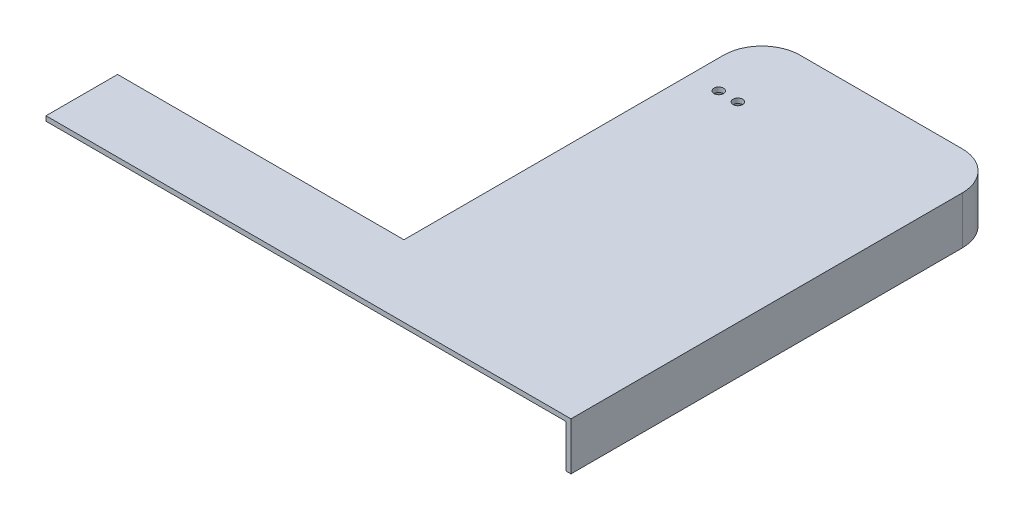
from build123d import *

# Parameters (mm, degrees)
BOSS_EXTRUDE1_DEPTH = 25.4
FILLET1_R           = 20.32
SHELL1_T            = -2.54
SKETCH2_R           = 2.54
CUT_EXTRUDE1_DEPTH  = 347.409815103
CUT_EXTRUDE2_DEPTH  = 347.409815103


with BuildPart() as part:
    # Sketch1 → Boss-Extrude1 (new body)
    with BuildSketch(Plane(origin=(0, 0, 0), x_dir=(1, 0, 0), z_dir=(0, 1, 0))):
        Polygon((-279.4, 203.2), (-279.4, -203.2), (279.4, -203.2), (279.4, 203.2), (152.4, 203.2), (152.4, 12.7), (-152.4, 12.7), (-152.4, 203.2), align=None)
    extrude(amount=BOSS_EXTRUDE1_DEPTH)

    # Fillet1
    fillet1_edges = [part.edges().sort_by_distance(p)[0] for p in [
        (279.4, 12.7, -203.2),
        (-279.4, 12.7, -203.2),
        (-152.4, 12.7, -203.2),
        (152.4, 12.7, -203.2),
    ]]
    fillet(fillet1_edges, radius=FILLET1_R)

    # Shell1
    shell1_openings = [part.faces().sort_by_distance(p)[0] for p in [
        (0, 0, 37.577423361),
    ]]
    offset(amount=SHELL1_T, openings=shell1_openings, kind=Kind.INTERSECTION)

    # Sketch2 → Cut-Extrude1 (cut, through all)
    with BuildSketch(Plane(origin=(0, 25.4, 0), x_dir=(1, 0, 0), z_dir=(0, 1, 0))):
        with Locations(Location((-177.72, 165.1, 0), (0, 0, 270))):
            Circle(SKETCH2_R)
        with Locations(Location((-167.56, 165.1, 0), (0, 0, 270))):
            Circle(SKETCH2_R)
        with Locations(Location((167.56, 165.1, 0), (0, 0, 270))):
            Circle(SKETCH2_R)
        with Locations(Location((177.72, 165.1, 0), (0, 0, 270))):
            Circle(SKETCH2_R)
    extrude(amount=-CUT_EXTRUDE1_DEPTH, mode=Mode.SUBTRACT)

    # Sketch3 → Cut-Extrude2 (cut, through all)
    with BuildSketch(Plane(origin=(0, 25.4, 0), x_dir=(1, 0, 0), z_dir=(0, 1, 0))):
        Polygon((279.4, -253.088506779), (279.4, -25.4), (0, -25.4), (0, 203.2), (-296.633483773, 203.2), (-305.626462942, -253.088506779), align=None)
    extrude(amount=-CUT_EXTRUDE2_DEPTH, mode=Mode.SUBTRACT)


solid = part.part
